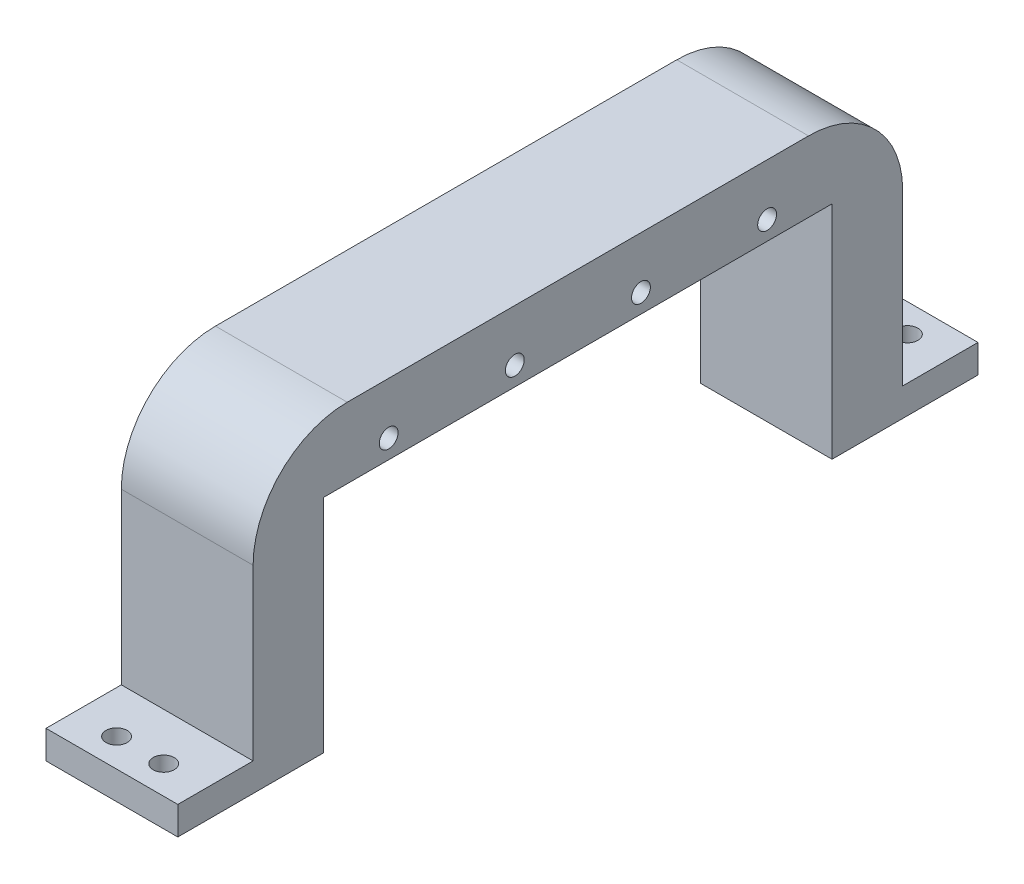
from build123d import *

# Parameters (mm, degrees)
BOSS_EXTRUDE1_DEPTH      = 7
BOSS_EXTRUDE1_DEPTH_BACK = 7
FILLET1_R                = 10
SKETCH2_R                = 1
CUT_EXTRUDE1_DEPTH       = 45.028399926
SKETCH3_R                = 1
CUT_EXTRUDE2_DEPTH       = 5
SKETCH4_W                = 14
SKETCH4_H                = 8
SKETCH4_R                = 1.122918174
BOSS_EXTRUDE2_DEPTH      = 3


with BuildPart() as part:
    # Sketch1 → Boss-Extrude1 (new, two sides: drawn at the far end of the back side and taken through both)
    with BuildSketch(Plane(origin=(0, 0, 0), x_dir=(0, 0, -1), z_dir=(1, 0, 0)).offset(-BOSS_EXTRUDE1_DEPTH_BACK)):
        Polygon((-27, 0), (27, 0), (27, -23.5), (34.5, -23.5), (34.5, 7.5), (-34.5, 7.5), (-34.5, -23.5), (-27, -23.5), align=None)
    extrude(amount=BOSS_EXTRUDE1_DEPTH + BOSS_EXTRUDE1_DEPTH_BACK)

    # Fillet1
    fillet1_edges = [part.edges().sort_by_distance(p)[0] for p in [
        (0, 7.5, 34.5),
        (0, 7.5, -34.5),
    ]]
    fillet(fillet1_edges, radius=FILLET1_R)

    # Sketch2 → Cut-Extrude1 (cut, through all)
    with BuildSketch(Plane(origin=(7, 0, 0), x_dir=(0, 0, -1), z_dir=(1, 0, 0))):
        with Locations((-6.7, 2)):
            Circle(SKETCH2_R)
        with Locations((-20.1, 2)):
            Circle(SKETCH2_R)
        with Locations((20.1, 2)):
            Circle(SKETCH2_R)
        with Locations((6.7, 2)):
            Circle(SKETCH2_R)
    extrude(amount=-CUT_EXTRUDE1_DEPTH, mode=Mode.SUBTRACT)

    # Sketch3 → Cut-Extrude2 (cut)
    with BuildSketch(Plane.XZ.offset(23.5)):
        with Locations((-2.5, -30.75)):
            Circle(SKETCH3_R)
        with Locations((2.5, -30.75)):
            Circle(SKETCH3_R)
        with Locations((-2.5, 30.75)):
            Circle(SKETCH3_R)
        with Locations((2.5, 30.75)):
            Circle(SKETCH3_R)
    extrude(amount=-CUT_EXTRUDE2_DEPTH, mode=Mode.SUBTRACT)

    # Sketch4 → Boss-Extrude2 (add)
    # profile 1 of 2: a face of its own
    with BuildSketch(Plane.XZ.offset(23.5)):
        with Locations((0, 38.5)):
            Rectangle(SKETCH4_W, SKETCH4_H)
        with Locations((-2.5, 39.5)):
            Circle(SKETCH4_R, mode=Mode.SUBTRACT)
        with Locations((2.5, 39.5)):
            Circle(SKETCH4_R, mode=Mode.SUBTRACT)
    # profile 2 of 2: a face of its own
    with BuildSketch(Plane.XZ.offset(23.5)):
        with Locations((0, -38.5)):
            Rectangle(SKETCH4_W, SKETCH4_H)
        with Locations((2.5, -39.5)):
            Circle(SKETCH4_R, mode=Mode.SUBTRACT)
        with Locations((-2.5, -39.5)):
            Circle(SKETCH4_R, mode=Mode.SUBTRACT)
    extrude(amount=-BOSS_EXTRUDE2_DEPTH)


solid = part.part
